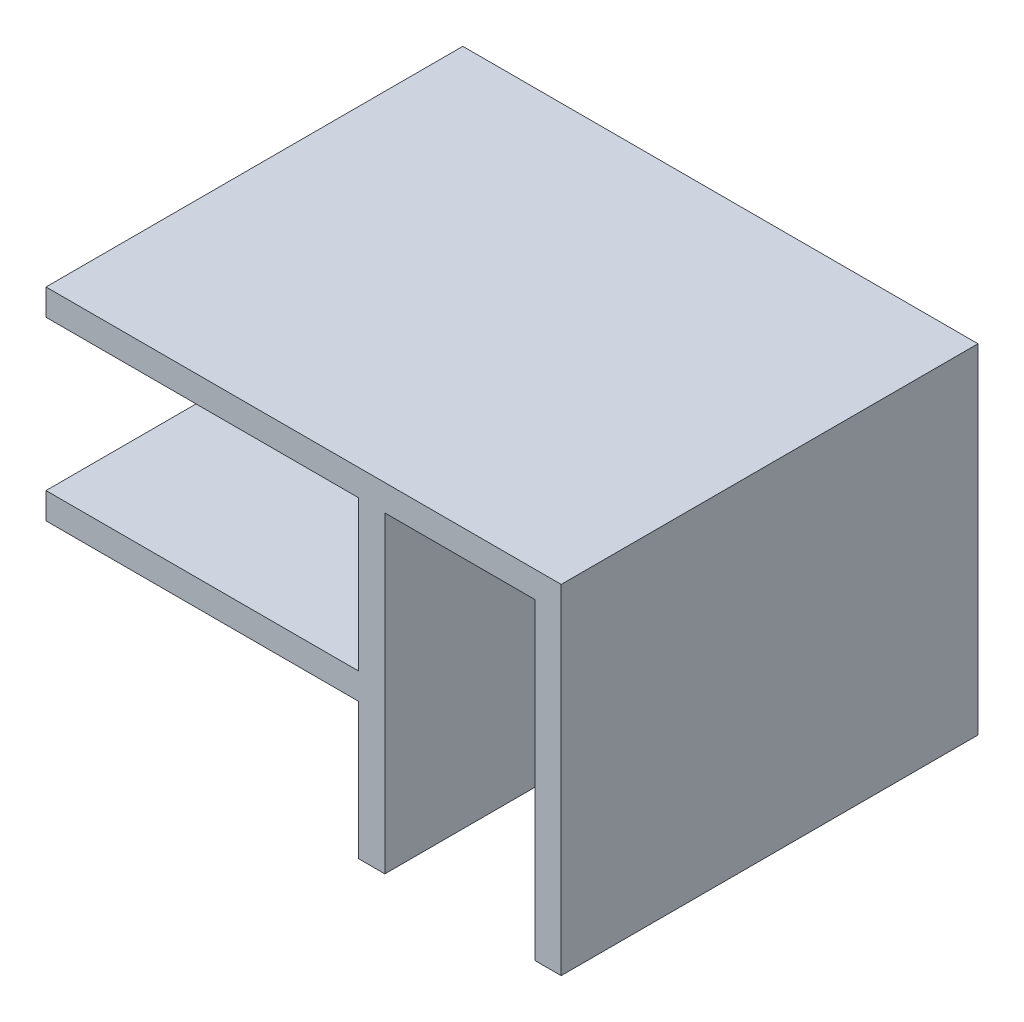
from build123d import *

# Parameters (mm, degrees)
BOSS_EXTRUDE1_DEPTH = 12.7


with BuildPart() as part:
    # Sketch2 → Boss-Extrude1 (new body)
    with BuildSketch(Plane.XY):
        Polygon((0, 0), (0, 4.153), (-9.525, 4.153), (-9.525, 4.953), (0, 4.953), (0, 9.525), (-9.525, 9.525), (-9.525, 10.325), (6.172, 10.325), (6.172, 0), (5.372, 0), (5.372, 9.525), (0.8, 9.525), (0.8, 0), align=None)
    extrude(amount=BOSS_EXTRUDE1_DEPTH)


solid = part.part
